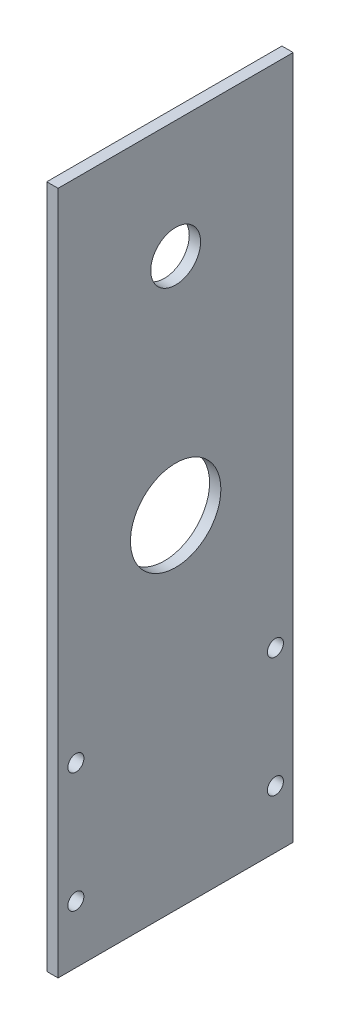
from build123d import *

# Parameters (mm, degrees)
SKETCH1_W           = 192.07988
SKETCH1_H           = 66.04
SKETCH1_R           = 7
SKETCH1_R_2         = 12.7
SKETCH1_R_3         = 2.25
BOSS_EXTRUDE1_DEPTH = 3.175


with BuildPart() as part:
    # Sketch1 → Boss-Extrude1 (new body)
    with BuildSketch(Plane.YZ):
        Rectangle(SKETCH1_W, SKETCH1_H)
        with Locations(Location((63.01994, 0, 0), (0, 0, 270))):
            Circle(SKETCH1_R, mode=Mode.SUBTRACT)
        with Locations(Location((0, 0, 0), (0, 0, 270))):
            Circle(SKETCH1_R_2, mode=Mode.SUBTRACT)
        with Locations(Location((-79.831946, 28.02001, 0), (0, 0, 270))):
            Circle(SKETCH1_R_3, mode=Mode.SUBTRACT)
        with Locations(Location((-79.831946, -28.02001, 0), (0, 0, 270))):
            Circle(SKETCH1_R_3, mode=Mode.SUBTRACT)
        with Locations(Location((-46.207934, -28.02001, 0), (0, 0, 270))):
            Circle(SKETCH1_R_3, mode=Mode.SUBTRACT)
        with Locations(Location((-46.207934, 28.02001, 0), (0, 0, 270))):
            Circle(SKETCH1_R_3, mode=Mode.SUBTRACT)
    extrude(amount=BOSS_EXTRUDE1_DEPTH)


solid = part.part
